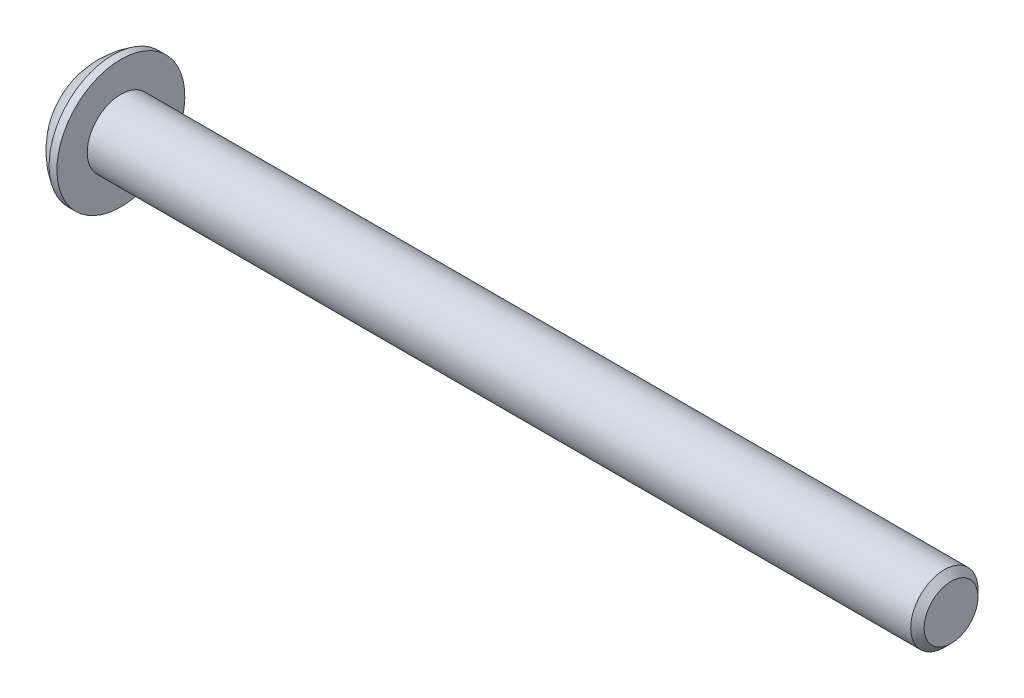
from build123d import *

# Parameters (mm, degrees)
CUT_EXTRUDE1_DEPTH = 1
CHAMFER1_SIZE      = 0.3


with BuildPart() as part:
    # Sketch1 → Revolve1 (revolve)
    with BuildSketch(Plane.XY):
        with BuildLine():
            Line((38.65, 0), (0, 0))
            Line((0, 0), (0, 1.425))
            ThreePointArc((0, 1.425), (0.545219548, 2.233089184), (1.3, 2.85))
            Line((1.3, 2.85), (1.65, 2.85))
            Line((1.65, 2.85), (1.65, 1.5))
            Line((1.65, 1.5), (38.65, 1.5))
            Line((38.65, 1.5), (38.65, 0))
        make_face()
    revolve(axis=Axis((38.65, 0, 0), (-1, 0, 0)))

    # Sketch2 → Cut-Extrude1 (cut)
    with BuildSketch(Plane.ZY):
        Polygon((1.009268217, 0.560991086), (0.018801577, 1.154547459), (-0.990466641, 0.593556372), (-1.009268217, -0.560991086), (-0.018801577, -1.154547459), (0.990466641, -0.593556372), align=None)
    extrude(amount=-CUT_EXTRUDE1_DEPTH, mode=Mode.SUBTRACT)

    # Chamfer1
    chamfer1_edges = [part.edges().sort_by_distance(p)[0] for p in [
        (38.65, -1.5, 0),
    ]]
    chamfer(chamfer1_edges, length=CHAMFER1_SIZE)


solid = part.part
